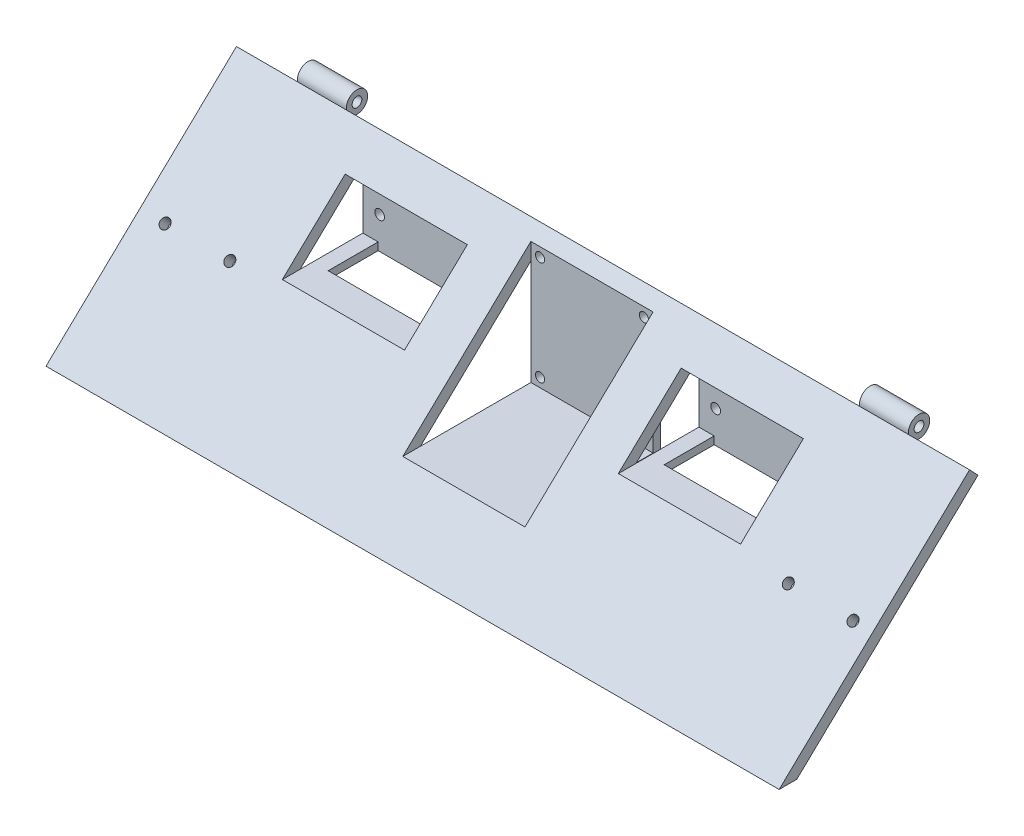
from build123d import *

# Parameters (mm, degrees)
EXTRUDE_1_DEPTH      = 120
EXTRUDE_1_DEPTH_BACK = 120
EXTRUDE_START        = 84
SKETCH_1_5_R         = 1.6
EXTRUDE_2_DEPTH      = 16
EXTRUDE_3_DEPTH      = 20
EXTRUDE_3_DEPTH_BACK = 20
CUT_EXTRUDE_1_REACH  = 148.454
SKETCH_3_W           = 40
SKETCH_3_H           = 34.471908326
SKETCH_3_H_2         = 5.528091674
SKETCH_4_R           = 1.5
CUT_EXTRUDE_2_DEPTH  = 147.454080652
EXTRUDE_START_2      = 35
SKETCH_5_W           = 2.5
SKETCH_5_H           = 2.5
EXTRUDE_4_DEPTH      = 40
CUT_EXTRUDE_3_REACH  = 148.454
SKETCH_6_W           = 40
SKETCH_6_H           = 19.615168576
SKETCH_7_W           = 30
SKETCH_7_H           = 16.35748171
CUT_EXTRUDE_4_DEPTH  = 2.5
SKETCH_8_R           = 1.6
CUT_EXTRUDE_5_DEPTH  = 2.5
SKETCH_9_R           = 1.6
CUT_EXTRUDE_6_DEPTH  = 4


with BuildPart() as part:
    # 草图1 → 凸台-拉伸1 (new, two sides: drawn at the far end of the back side and taken through both)
    with BuildSketch(Plane(origin=(0, 0, 0), x_dir=(0, 0, -1), z_dir=(1, 0, 0)).offset(-EXTRUDE_1_DEPTH_BACK)):
        with BuildLine():
            Line((-3.458804046, -0.535419994), (-62.760974675, -57.105691992))
            Line((-62.760974675, -57.105691992), (-60, -60))
            Line((-60, -60), (-0.697829371, -3.429728002))
            ThreePointArc((-0.697829371, -3.429728002), (-2.532519507, -2.41585284), (-3.458804046, -0.535419994))
        make_face()
        Polygon((-62.760974675, -57.105691992), (-65.795054966, -60), (-60, -60), align=None)
        with BuildLine():
            Line((-0.697829371, -3.429728002), (-3.458804046, -0.535419994))
            ThreePointArc((-3.458804046, -0.535419994), (-2.532519507, -2.41585284), (-0.697829371, -3.429728002))
        make_face()
    extrude(amount=EXTRUDE_1_DEPTH + EXTRUDE_1_DEPTH_BACK)

    # 草图1<5> → 凸台-拉伸2 (add)
    with BuildSketch(Plane(origin=(0, 0, 0), x_dir=(0, 0, -1), z_dir=(1, 0, 0)).offset(EXTRUDE_START)):
        with BuildLine():
            ThreePointArc((3.5, 0), (-0.268501246, 3.489685814), (-3.458804046, -0.535419994))
            Line((-3.458804046, -0.535419994), (-0.697829371, -3.429728002))
            ThreePointArc((-0.697829371, -3.429728002), (2.214452212, -2.710387684), (3.5, 0))
        make_face()
        Circle(SKETCH_1_5_R, mode=Mode.SUBTRACT)
    extrude_2 = extrude(amount=EXTRUDE_2_DEPTH)

    # 镜向1: 凸台-拉伸2 across plane
    add(extrude_2.mirror(Plane(origin=(0, 0, 0), x_dir=(0, 0, 1), z_dir=(1, 0, 0))))

    # 草图2 → 凸台-拉伸3 (add, two sides: drawn at the far end of the back side and taken through both)
    with BuildSketch(Plane(origin=(0, 0, 0), x_dir=(0, 0, -1), z_dir=(1, 0, 0)).offset(-EXTRUDE_3_DEPTH_BACK)):
        Polygon((-4.568589556, -7.12217221), (-7.068589556, -9.507003634), (-7.068589556, -43.97891196), (-43.205219579, -43.97891196), (-45.82594989, -46.47891196), (-4.568589556, -46.47891196), align=None)
    extrude(amount=EXTRUDE_3_DEPTH + EXTRUDE_3_DEPTH_BACK)

    # 切除-拉伸1: up to this face of the body (flat: up to its plane)
    cut_extrude_1_end = Plane(part.part.faces().sort_by_distance((0, -30.267709997, 34.626929506))[0])
    # 草图3 → 切除-拉伸1 (cut, up to the picked face)
    with BuildSketch(Plane.XY.offset(7.068589556), mode=Mode.PRIVATE) as cut_extrude_1_sk1:
        with Locations((0, -26.742957797)):
            Rectangle(SKETCH_3_W, SKETCH_3_H)
    cut_extrude_1_tool1 = split(extrude(cut_extrude_1_sk1.sketch, amount=CUT_EXTRUDE_1_REACH, mode=Mode.PRIVATE), bisect_by=cut_extrude_1_end, keep=Keep.BOTH, mode=Mode.PRIVATE)
    # 草图3 → 切除-拉伸1 (cut, up to the picked face)
    with BuildSketch(Plane.XY.offset(7.068589556), mode=Mode.PRIVATE) as cut_extrude_1_sk2:
        with Locations((0, -6.742957797)):
            Rectangle(SKETCH_3_W, SKETCH_3_H_2)
    cut_extrude_1_tool2 = split(extrude(cut_extrude_1_sk2.sketch, amount=CUT_EXTRUDE_1_REACH, mode=Mode.PRIVATE), bisect_by=cut_extrude_1_end, keep=Keep.BOTH, mode=Mode.PRIVATE)
    add(cut_extrude_1_tool1.solids().sort_by(Axis((0, -26.742958, 7.06859), (0, 0, 1)))[0], mode=Mode.SUBTRACT)
    add(cut_extrude_1_tool2.solids().sort_by(Axis((0, -6.742958, 7.06859), (0, 0, 1)))[0], mode=Mode.SUBTRACT)

    # 草图4 → 切除-拉伸2 (cut, through all)
    with BuildSketch(Plane.XY.offset(7.068589556)):
        with Locations((-17, -6.97891196)):
            Circle(SKETCH_4_R)
        with Locations((17, -6.97891196)):
            Circle(SKETCH_4_R)
        with Locations((17, -40.97891196)):
            Circle(SKETCH_4_R)
        with Locations((-17, -40.97891196)):
            Circle(SKETCH_4_R)
    extrude(amount=-CUT_EXTRUDE_2_DEPTH, mode=Mode.SUBTRACT)

    # 草图5 → 凸台-拉伸4 (add)
    with BuildSketch(Plane(origin=(0, 0, 0), x_dir=(0, 0, -1), z_dir=(1, 0, 0)).offset(EXTRUDE_START_2)):
        Polygon((-27.6310163, -29.12217221), (-30.251746612, -31.62217221), (-7.068589556, -31.62217221), (-7.068589556, -29.12217221), align=None)
        Polygon((-7.068589556, -29.12217221), (-4.568589556, -29.12217221), (-4.568589556, -7.12217221), (-7.068589556, -9.507003634), align=None)
        with Locations((-5.818589556, -30.37217221)):
            Rectangle(SKETCH_5_W, SKETCH_5_H)
    extrude_4 = extrude(amount=EXTRUDE_4_DEPTH)

    # 切除-拉伸3: up to this plane
    cut_extrude_3_end = Plane(origin=(-120, 1.447154004, 1.380487337), z_dir=(0, -0.7235770020149496, -0.6902436686816169))
    # 草图6 → 切除-拉伸3 (cut, up to the surface)
    with BuildSketch(Plane.XY.offset(7.068589556), mode=Mode.PRIVATE) as cut_extrude_3_sk1:
        with Locations((55, -19.314587922)):
            Rectangle(SKETCH_6_W, SKETCH_6_H)
    cut_extrude_3_tool1 = split(extrude(cut_extrude_3_sk1.sketch, amount=CUT_EXTRUDE_3_REACH, mode=Mode.PRIVATE), bisect_by=cut_extrude_3_end, keep=Keep.BOTH, mode=Mode.PRIVATE)
    cut_extrude_3 = cut_extrude_3_tool1.solids().sort_by_distance((55, -19.314588, 7.06859))[0]
    add(cut_extrude_3, mode=Mode.SUBTRACT)

    # 草图7 → 切除-拉伸4 (cut)
    with BuildSketch(Plane(origin=(0, -29.12217221, 0), x_dir=(1, 0, 0), z_dir=(0, 1, 0))):
        with Locations((55, -15.247330411)):
            Rectangle(SKETCH_7_W, SKETCH_7_H)
    cut_extrude_4 = extrude(amount=-CUT_EXTRUDE_4_DEPTH, mode=Mode.SUBTRACT)

    # 草图8 → 切除-拉伸5 (cut)
    with BuildSketch(Plane.XY.offset(7.068589556)):
        with Locations((40.5, -21.12217221)):
            Circle(SKETCH_8_R)
        with Locations((69.5, -21.12217221)):
            Circle(SKETCH_8_R)
    cut_extrude_5 = extrude(amount=-CUT_EXTRUDE_5_DEPTH, mode=Mode.SUBTRACT)

    # 镜向2: 凸台-拉伸4 across plane
    add(extrude_4.mirror(Plane(origin=(0, 0, 0), x_dir=(0, 0, 1), z_dir=(1, 0, 0))))

    # 镜向3: 切除-拉伸4 across plane
    add(cut_extrude_4.mirror(Plane(origin=(0, 0, 0), x_dir=(0, 0, 1), z_dir=(1, 0, 0))), mode=Mode.SUBTRACT)

    # 镜向4: 切除-拉伸5 across plane
    add(cut_extrude_5.mirror(Plane(origin=(0, 0, 0), x_dir=(0, 0, 1), z_dir=(1, 0, 0))), mode=Mode.SUBTRACT)

    # 镜向5: 切除-拉伸3 across plane
    add(cut_extrude_3.mirror(Plane(origin=(0, 0, 0), x_dir=(0, 0, 1), z_dir=(1, 0, 0))), mode=Mode.SUBTRACT)

    # 草图9 → 切除-拉伸6 (cut)
    with BuildSketch(Plane(origin=(0, -1.447154004, -1.380487337), x_dir=(1, 0, 0), z_dir=(0, -0.7235770020149502, -0.6902436686816162))):
        with Locations(Location((113.511233503, 46.629240242, 0), (0, 0, 270))):
            Circle(SKETCH_9_R)
        with Locations(Location((92.317392528, 46.629240242, 0), (0, 0, 270))):
            Circle(SKETCH_9_R)
        with Locations(Location((-90.488766497, 46.629240242, 0), (0, 0, 270))):
            Circle(SKETCH_9_R)
        with Locations(Location((-111.682607472, 46.629240242, 0), (0, 0, 270))):
            Circle(SKETCH_9_R)
    extrude(amount=-CUT_EXTRUDE_6_DEPTH, mode=Mode.SUBTRACT)


solid = part.part
